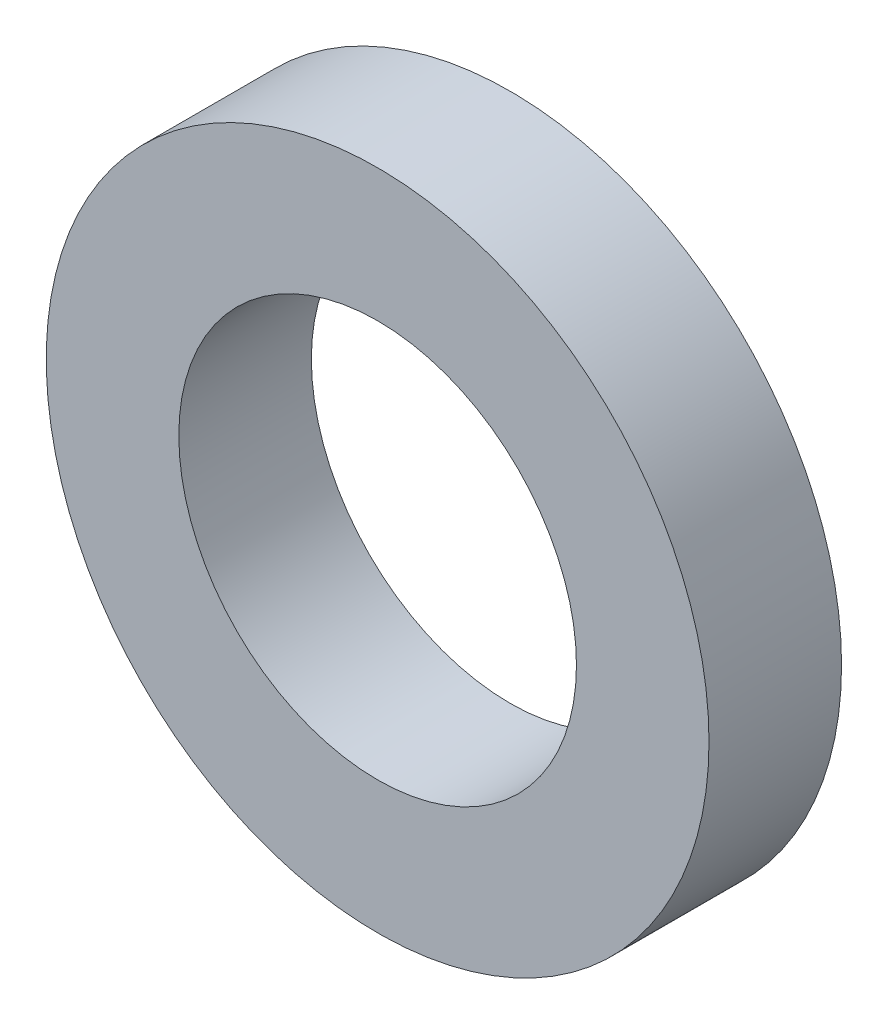
from build123d import *

# Parameters (mm, degrees)
SKETCH_1_R      = 25
SKETCH_1_R_2    = 15
EXTRUDE_1_DEPTH = 10


with BuildPart() as part:
    # Эскиз1 → Вытянуть1 (new body)
    with BuildSketch(Plane.XY):
        Circle(SKETCH_1_R)
        Circle(SKETCH_1_R_2, mode=Mode.SUBTRACT)
    extrude(amount=EXTRUDE_1_DEPTH)


solid = part.part
